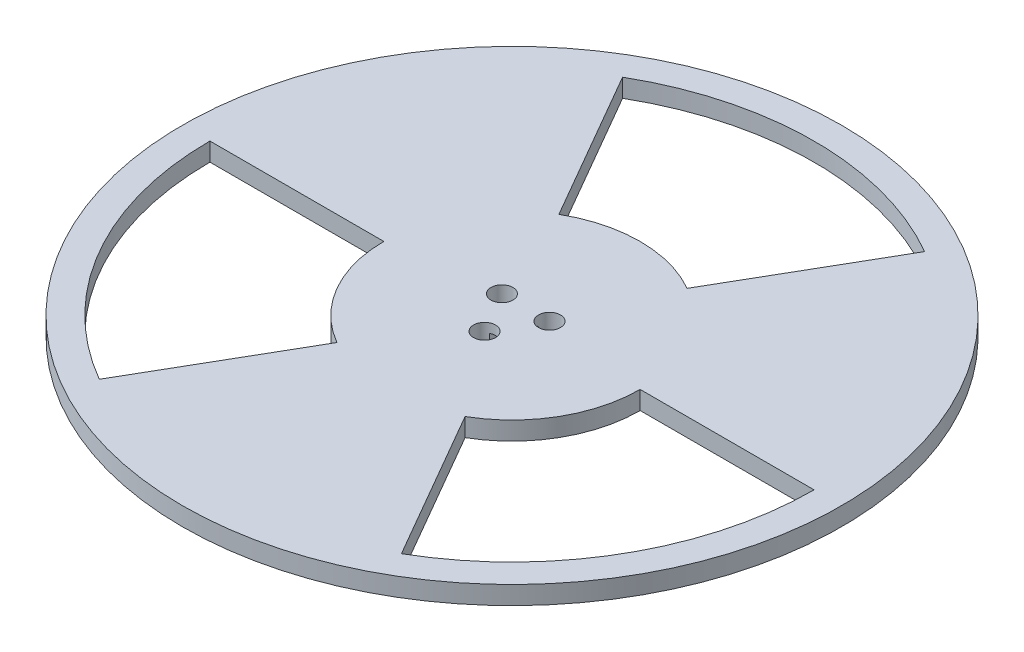
from build123d import *

# Parameters (mm, degrees)
SKETCH1_R           = 18
BOSS_EXTRUDE1_DEPTH = 1
SKETCH2_R           = 2
BOSS_EXTRUDE2_DEPTH = 2
SKETCH3_R           = 1
CUT_EXTRUDE1_DEPTH  = 2.5
FILLET1_R           = 1
SKETCH4_R           = 0.6
CUT_EXTRUDE2_DEPTH  = 1


with BuildPart() as part:
    # Sketch1 → Boss-Extrude1 (new body)
    with BuildSketch(Plane(origin=(0, 0, 0), x_dir=(1, 0, 0), z_dir=(0, 1, 0))):
        with Locations(Location((0, 0, 0), (0, 0, 270))):
            Circle(SKETCH1_R)
    extrude(amount=BOSS_EXTRUDE1_DEPTH)

    # Sketch2 → Boss-Extrude2 (add)
    with BuildSketch(Plane.XZ):
        with Locations(Location((0, 0, 0), (0, 0, 90))):
            Circle(SKETCH2_R)
    extrude(amount=BOSS_EXTRUDE2_DEPTH)

    # Sketch3 → Cut-Extrude1 (cut)
    with BuildSketch(Plane.XZ.offset(2)):
        with Locations(Location((0, 0, 0), (0, 0, 270))):
            Circle(SKETCH3_R)
    extrude(amount=-CUT_EXTRUDE1_DEPTH, mode=Mode.SUBTRACT)

    # Fillet1
    fillet1_edges = [part.edges().sort_by_distance(p)[0] for p in [
        (0, 0, -2),
    ]]
    fillet(fillet1_edges, radius=FILLET1_R)

    # Sketch4 → Cut-Extrude2 (cut)
    with BuildSketch(Plane(origin=(0, 1, 0), x_dir=(1, 0, 0), z_dir=(0, 1, 0))):
        with Locations(Location((1.299038106, 0.75, 0), (0, 0, 270))):
            Circle(SKETCH4_R)
        with Locations(Location((0, -1.5, 0), (0, 0, 270))):
            Circle(SKETCH4_R)
        with Locations(Location((-1.299038106, 0.75, 0), (0, 0, 270))):
            Circle(SKETCH4_R)
        with BuildLine():
            Line((-3.5, 6.062177826), (-8.25, 14.289419162))
            ThreePointArc((-8.25, 14.289419162), (0, 16.5), (8.25, 14.289419162))
            Line((8.25, 14.289419162), (3.5, 6.062177826))
            ThreePointArc((3.5, 6.062177826), (0, 7), (-3.5, 6.062177826))
        make_face()
        with BuildLine():
            Line((7, 0), (16.5, 0))
            ThreePointArc((16.5, 0), (14.289419162, -8.25), (8.25, -14.289419162))
            Line((8.25, -14.289419162), (3.5, -6.062177826))
            ThreePointArc((3.5, -6.062177826), (6.062177826, -3.5), (7, 0))
        make_face()
        with BuildLine():
            Line((-3.5, -6.062177826), (-8.25, -14.289419162))
            ThreePointArc((-8.25, -14.289419162), (-14.289419162, -8.25), (-16.5, 0))
            Line((-16.5, 0), (-7, 0))
            ThreePointArc((-7, 0), (-6.062177826, -3.5), (-3.5, -6.062177826))
        make_face()
    extrude(amount=-CUT_EXTRUDE2_DEPTH, mode=Mode.SUBTRACT)


solid = part.part
